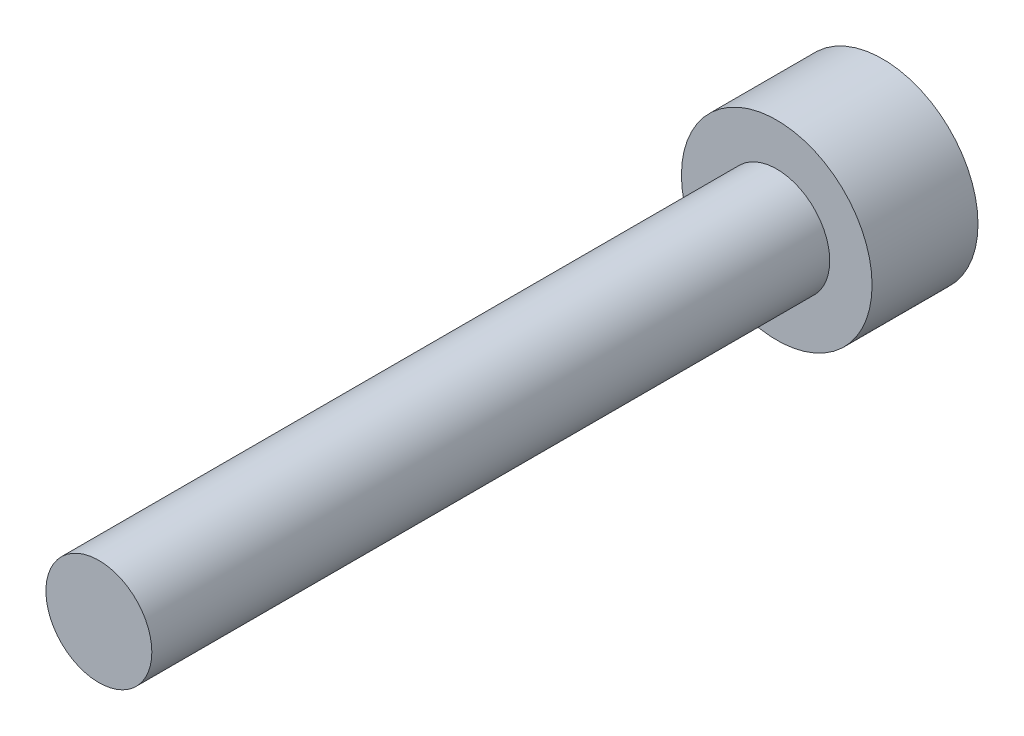
from build123d import *

# Parameters (mm, degrees)
CABEZA_START            = -2.5
CROQUIS1_R              = 2.25
CABEZA_DEPTH            = 2.5
CROQUIS2_R              = 1.25
CUERPO_DEPTH            = 16
HEXAGONO_INTERIOR_START = -2.5
HEXAGONO_INTERIOR_DEPTH = 1.1


with BuildPart() as part:
    # Croquis1 → Cabeza (new body)
    with BuildSketch(Plane.XY.offset(CABEZA_START)):
        Circle(CROQUIS1_R)
    extrude(amount=CABEZA_DEPTH)

    # Croquis2 → Cuerpo (add)
    with BuildSketch(Plane.XY):
        Circle(CROQUIS2_R)
    extrude(amount=CUERPO_DEPTH)

    # Croquis3 → Hexagono_interior (cut)
    with BuildSketch(Plane.XY.offset(HEXAGONO_INTERIOR_START)):
        Polygon((1.154700538, 0), (0.577350269, 1), (-0.577350269, 1), (-1.154700538, 0), (-0.577350269, -1), (0.577350269, -1), align=None)
    extrude(amount=HEXAGONO_INTERIOR_DEPTH, mode=Mode.SUBTRACT)


solid = part.part
